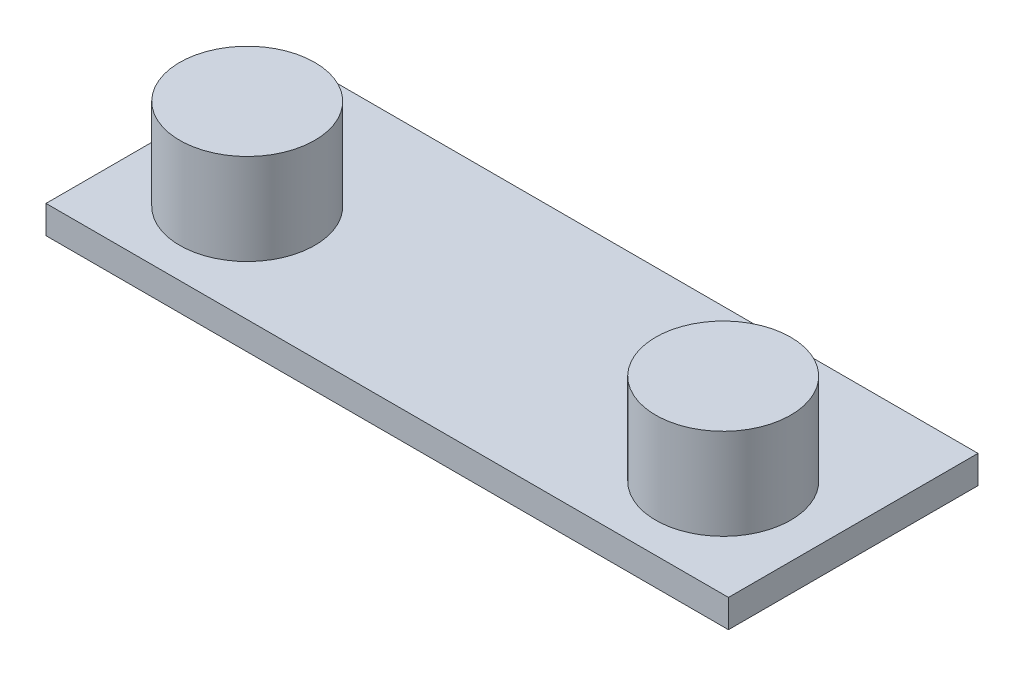
from build123d import *

# Parameters (mm, degrees)
SKETCH_1_W      = 195
SKETCH_1_H      = 71.3
EXTRUDE_1_DEPTH = 8
SKETCH_2_R      = 19.3
EXTRUDE_2_DEPTH = 26


with BuildPart() as part:
    # 草图1 → 凸台-拉伸1 (new body)
    with BuildSketch(Plane(origin=(0, 0, 0), x_dir=(1, 0, 0), z_dir=(0, 1, 0))):
        Rectangle(SKETCH_1_W, SKETCH_1_H)
    extrude(amount=EXTRUDE_1_DEPTH)

    # 草图2 → 凸台-拉伸2 (add)
    with BuildSketch(Plane(origin=(0, 8, 0), x_dir=(1, 0, 0), z_dir=(0, 1, 0))):
        with Locations(Location((68, -7.65, 0), (0, 0, 90))):
            Circle(SKETCH_2_R)
        with Locations(Location((-68, -7.65, 0), (0, 0, 90))):
            Circle(SKETCH_2_R)
    extrude(amount=EXTRUDE_2_DEPTH)


solid = part.part
